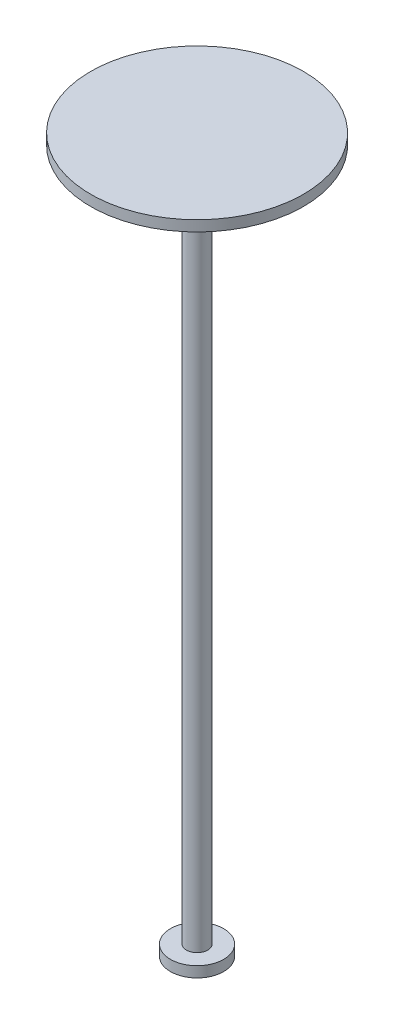
from build123d import *


with BuildPart() as part:
    # Sketch1 → Revolve1 (revolve)
    with BuildSketch(Plane.XY, mode=Mode.PRIVATE) as revolve1_sk:
        Polygon((0, 0), (0, 165.246830829), (25.4, 165.246830829), (25.4, 162.706830829), (2.54, 162.706830829), (2.54, -2.393169171), (6.35, -2.393169171), (6.35, -4.933169171), (0, -4.933169171), align=None)
    revolve(revolve1_sk.sketch.rotate(Axis((0, 0, 0), (0, 1, 0)), 90), axis=Axis((0, 0, 0), (0, 1, 0)))


solid = part.part
